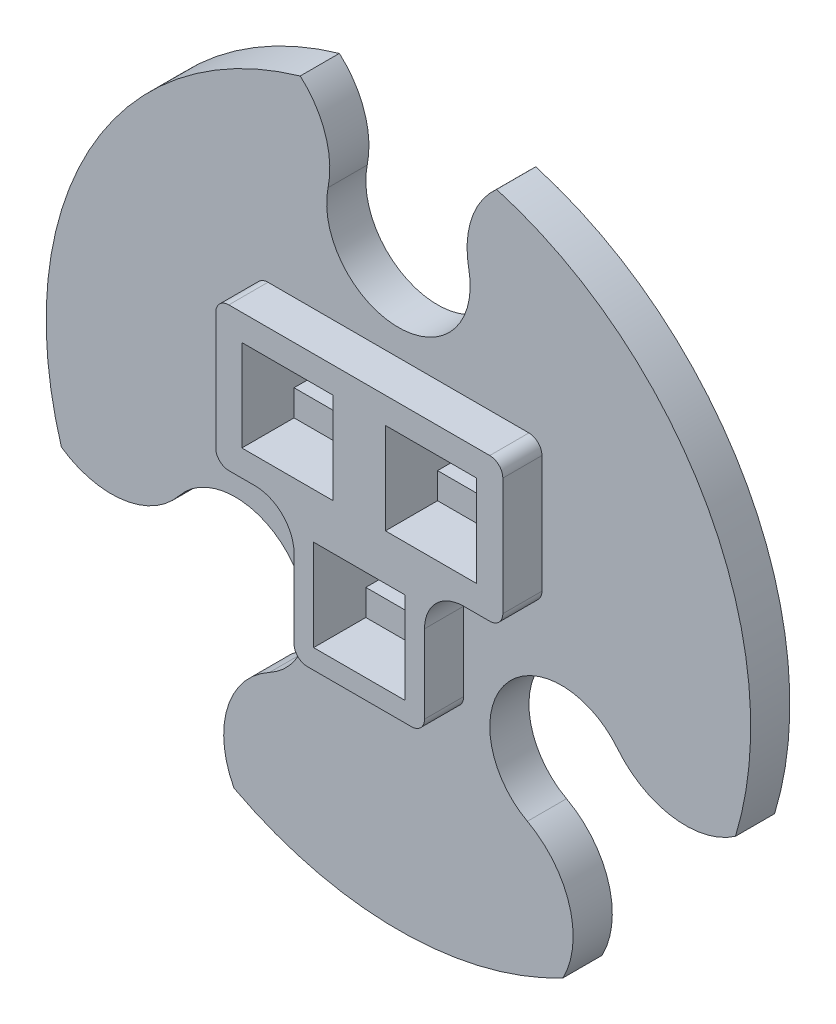
from build123d import *
from OCP.BRepFilletAPI import BRepFilletAPI_MakeFillet

# Parameters (mm, degrees)
SKETCH1_W           = 5.5
SKETCH1_H           = 5.5
BOSS_EXTRUDE1_DEPTH = 1.5
SKETCH5_W           = 5
SKETCH5_H           = 5
BOSS_EXTRUDE2_DEPTH = 3
SKETCH2_W           = 3.5
SKETCH2_H           = 3.5
CUT_EXTRUDE1_DEPTH  = 2
SKETCH10_W          = 3.5
SKETCH10_H          = 1.5
CUT_EXTRUDE3_DEPTH  = 9.031189202
FILLET7_R1          = 0.5
FILLET7_R2          = 1.5
BOSS_EXTRUDE3_DEPTH = 1.5


with BuildPart() as part:
    # Sketch1 → Boss-Extrude1 (new, symmetric)
    with BuildSketch(Plane.XY):
        with Locations((2.75, 2.75)):
            Rectangle(SKETCH1_W, SKETCH1_H)
        with Locations((-2.75, 2.75)):
            Rectangle(SKETCH1_W, SKETCH1_H)
    extrude(amount=BOSS_EXTRUDE1_DEPTH, both=True)

    # Sketch5 → Boss-Extrude2 (add)
    with BuildSketch(Plane.XY.offset(1.5)):
        with Locations((0, -2.5)):
            Rectangle(SKETCH5_W, SKETCH5_H)
    extrude(amount=-BOSS_EXTRUDE2_DEPTH)

    # Sketch2 → Cut-Extrude1 (cut)
    with BuildSketch(Plane.XY.offset(1.5)):
        with Locations((2.75, 2.75)):
            Rectangle(SKETCH2_W, SKETCH2_H)
        with Locations((-2.75, 2.75)):
            Rectangle(SKETCH2_W, SKETCH2_H)
        with Locations((0, -2.5)):
            Rectangle(SKETCH2_W, SKETCH2_H)
    extrude(amount=-CUT_EXTRUDE1_DEPTH, mode=Mode.SUBTRACT)

    # Sketch10 → Cut-Extrude3 (cut, through all)
    with BuildSketch(Plane.XY.offset(-0.5)):
        with Locations((0, -2.5)):
            Rectangle(SKETCH10_W, SKETCH10_H)
        with Locations((2.75, 2.75)):
            Rectangle(SKETCH10_W, SKETCH10_H)
        with Locations((-2.75, 2.75)):
            Rectangle(SKETCH10_W, SKETCH10_H)
    extrude(amount=-CUT_EXTRUDE3_DEPTH, mode=Mode.SUBTRACT)

    # Fillet7: one fillet with a radius per group of edges: ONE call of the kernel's fillet builder (fillet() takes one radius for all edges)
    fillet7_edges_1 = [part.edges().sort_by_distance(p)[0] for p in [
        (5.5, 0, 0),
        (2.5, -5, 0),
        (5.5, 5.5, 0),
        (-5.5, 5.5, 0),
        (-5.5, 0, 0),
        (-2.5, -5, 0),
    ]]
    fillet7_edges_2 = [part.edges().sort_by_distance(p)[0] for p in [
        (2.5, 0, 0),
        (-2.5, 0, 0),
    ]]
    fillet7 = BRepFilletAPI_MakeFillet(part.part.solid().wrapped)
    for e in fillet7_edges_1:
        fillet7.Add(FILLET7_R1, e.wrapped)
    for e in fillet7_edges_2:
        fillet7.Add(FILLET7_R2, e.wrapped)
    add(Compound.cast(fillet7.Shape()), mode=Mode.REPLACE)

    # Sketch11 → Boss-Extrude3 (add, through all)
    with BuildSketch(Plane.XY):
        with BuildLine():
            ThreePointArc((-6.301018176, -11.939311954), (8.8396e-05, -13.5), (6.301174529, -11.939229437))
            ThreePointArc((6.301174529, -11.939229437), (6.554033768, -9.398401396), (4.941977619, -7.41824486))
            ThreePointArc((4.941977619, -7.41824486), (4.139435534, -3.238722534), (8.395134632, -3.277528018))
            ThreePointArc((8.395134632, -3.277528018), (10.526696598, -4.494141765), (12.915304874, -3.93))
            ThreePointArc((12.915304874, -3.93), (11.870145687, 6.430368681), (3.762845966, 12.964990946))
            ThreePointArc((3.762845966, 12.964990946), (2.804609837, 11.521965342), (2.695822199, 9.793178304))
            ThreePointArc((2.695822199, 9.793178304), (0, 6.5), (-2.695822199, 9.793178304))
            ThreePointArc((-2.695822199, 9.793178304), (-2.804609837, 11.521965342), (-3.762845966, 12.964990946))
            ThreePointArc((-3.762845966, 12.964990946), (-11.870183671, 6.430298564), (-12.915258444, -3.930152581))
            ThreePointArc((-12.915258444, -3.930152581), (-10.526666364, -4.494205663), (-8.395162612, -3.277562841))
            ThreePointArc((-8.395162612, -3.277562841), (-4.139464145, -3.238688227), (-4.941938337, -7.418223589))
            ThreePointArc((-4.941938337, -7.418223589), (-6.553975653, -9.398450665), (-6.301018176, -11.939311954))
        make_face()
        with BuildLine():
            Line((-2.5, -1.5), (-2.5, -4.5))
            ThreePointArc((-2.5, -4.5), (-2.353553391, -4.853553391), (-2, -5))
            Line((-2, -5), (2, -5))
            ThreePointArc((2, -5), (2.353553391, -4.853553391), (2.5, -4.5))
            Line((2.5, -4.5), (2.5, -1.5))
            ThreePointArc((2.5, -1.5), (2.939339828, -0.439339828), (4, 0))
            Line((4, 0), (5, 0))
            ThreePointArc((5, 0), (5.353553391, 0.146446609), (5.5, 0.5))
            Line((5.5, 0.5), (5.5, 5))
            ThreePointArc((5.5, 5), (5.353553391, 5.353553391), (5, 5.5))
            Line((5, 5.5), (-5, 5.5))
            ThreePointArc((-5, 5.5), (-5.353553391, 5.353553391), (-5.5, 5))
            Line((-5.5, 5), (-5.5, 0.5))
            ThreePointArc((-5.5, 0.5), (-5.353553391, 0.146446609), (-5, 0))
            Line((-5, 0), (-4, 0))
            ThreePointArc((-4, 0), (-2.939339828, -0.439339828), (-2.5, -1.5))
        make_face(mode=Mode.SUBTRACT)
    extrude(amount=-BOSS_EXTRUDE3_DEPTH)


solid = part.part
